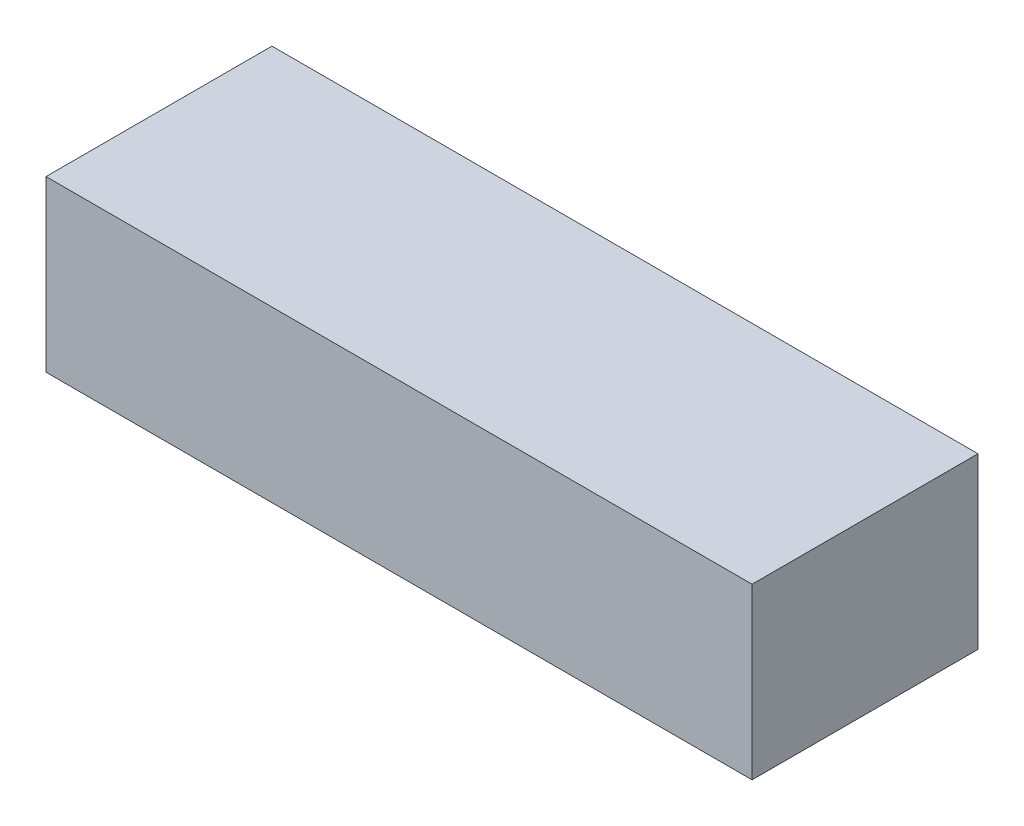
from build123d import *

# Parameters (mm, degrees)
SKETCH1_W           = 875
SKETCH1_H           = 280
BOSS_EXTRUDE1_DEPTH = 210


with BuildPart() as part:
    # Sketch1 → Boss-Extrude1 (new body)
    with BuildSketch(Plane(origin=(0, 0, 0), x_dir=(1, 0, 0), z_dir=(0, 1, 0))):
        with Locations((0, 140)):
            Rectangle(SKETCH1_W, SKETCH1_H)
    extrude(amount=-BOSS_EXTRUDE1_DEPTH)


solid = part.part
